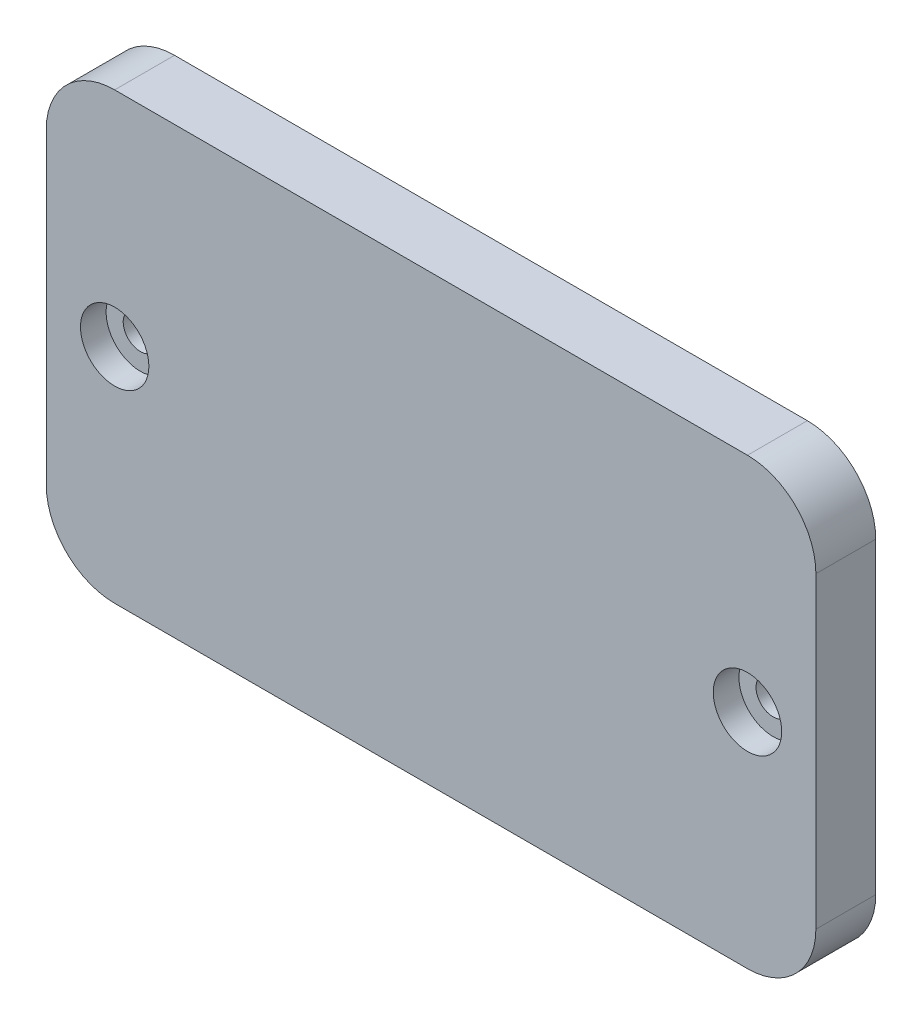
from build123d import *

# Parameters (mm, degrees)
SKETCH1_W           = 45
SKETCH1_H           = 26
SKETCH1_R           = 1
BOSS_EXTRUDE1_DEPTH = 3.5
FILLET1_R           = 4
SKETCH2_R           = 2
CUT_EXTRUDE1_DEPTH  = 1.5


with BuildPart() as part:
    # Sketch1 → Boss-Extrude1 (new body)
    with BuildSketch(Plane.XY):
        with Locations((18.5, 0)):
            Rectangle(SKETCH1_W, SKETCH1_H)
        Circle(SKETCH1_R, mode=Mode.SUBTRACT)
        with Locations((37, 0)):
            Circle(SKETCH1_R, mode=Mode.SUBTRACT)
    extrude(amount=BOSS_EXTRUDE1_DEPTH)

    # Fillet1
    fillet1_edges = [part.edges().sort_by_distance(p)[0] for p in [
        (-4, 13, 1.75),
        (41, 13, 1.75),
        (41, -13, 1.75),
        (-4, -13, 1.75),
    ]]
    fillet(fillet1_edges, radius=FILLET1_R)

    # Sketch2 → Cut-Extrude1 (cut)
    with BuildSketch(Plane.XY.offset(3.5)):
        Circle(SKETCH2_R)
        with Locations((37, 0)):
            Circle(SKETCH2_R)
    extrude(amount=-CUT_EXTRUDE1_DEPTH, mode=Mode.SUBTRACT)


solid = part.part
